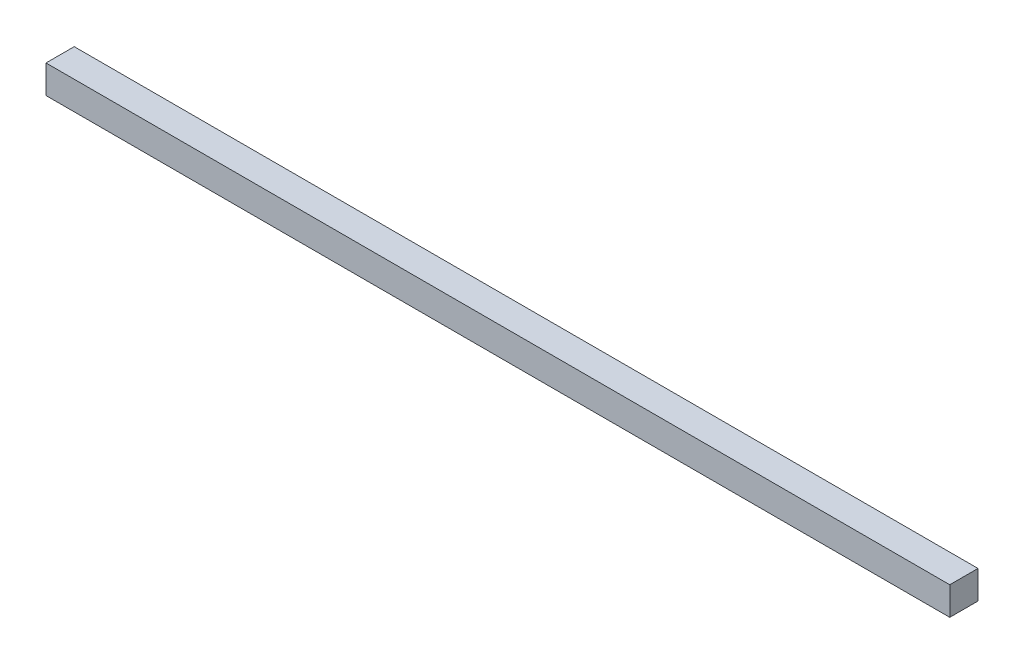
from build123d import *

# Parameters (mm, degrees)
SKETCH1_W      = 1219.2
SKETCH1_H      = 38.1
EXTRUDE1_DEPTH = 38.1


with BuildPart() as part:
    # Sketch1 → Extrude1 (new body)
    with BuildSketch(Plane(origin=(0, 0, 0), x_dir=(1, 0, 0), z_dir=(0, 1, 0))):
        with Locations((609.6, 19.05)):
            Rectangle(SKETCH1_W, SKETCH1_H)
    extrude(amount=EXTRUDE1_DEPTH)


solid = part.part
